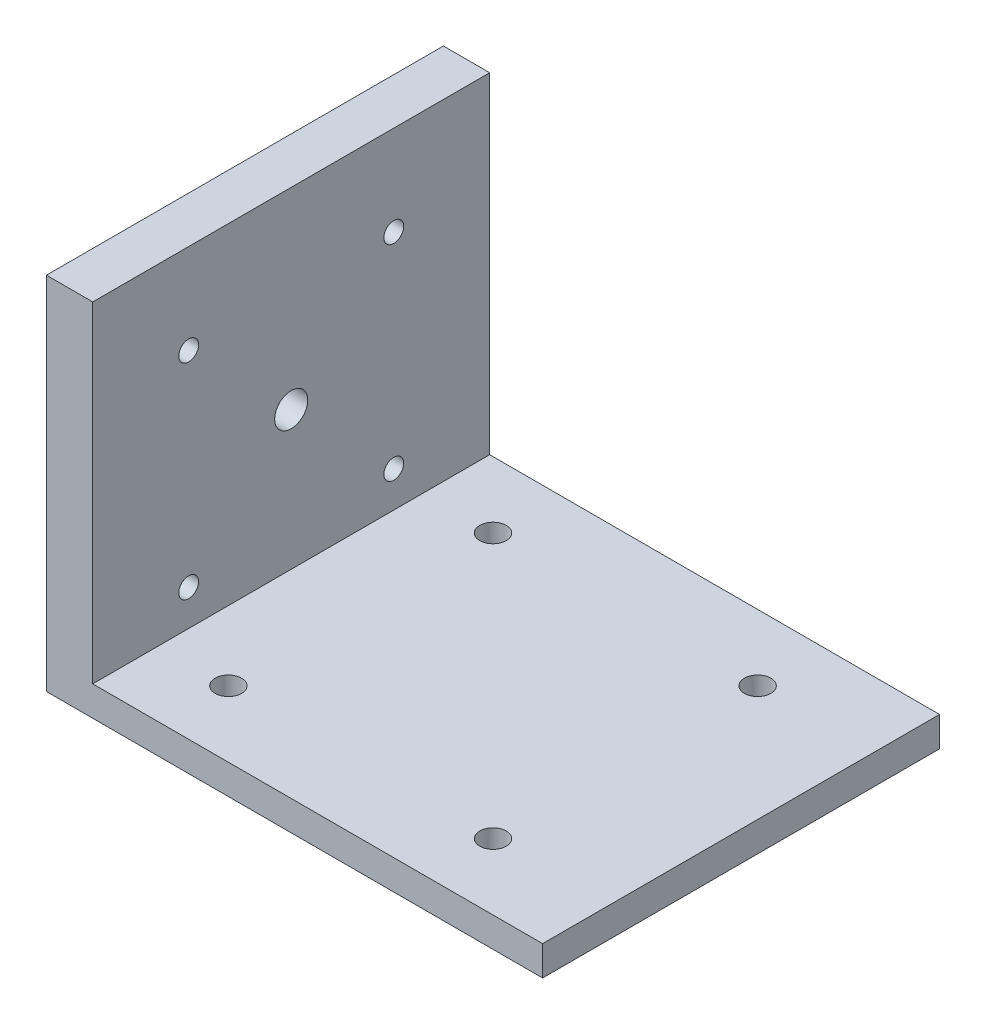
from build123d import *

# Parameters (mm, degrees)
SKETCH1_W           = 75
SKETCH1_H           = 60
BOSS_EXTRUDE1_DEPTH = 4.5
SKETCH2_W           = 7
SKETCH2_H           = 60
BOSS_EXTRUDE2_DEPTH = 50
SKETCH3_R           = 1.5
SKETCH3_R_2         = 2.5
CUT_EXTRUDE1_DEPTH  = 10
SKETCH6_R           = 2
CUT_EXTRUDE2_DEPTH  = 10


with BuildPart() as part:
    # Sketch1 → Boss-Extrude1 (new body)
    with BuildSketch(Plane(origin=(0, 0, 0), x_dir=(1, 0, 0), z_dir=(0, 1, 0))):
        Rectangle(SKETCH1_W, SKETCH1_H)
    extrude(amount=BOSS_EXTRUDE1_DEPTH)

    # Sketch2 → Boss-Extrude2 (add)
    with BuildSketch(Plane(origin=(0, 4.5, 0), x_dir=(1, 0, 0), z_dir=(0, 1, 0))):
        with Locations((-34, 0)):
            Rectangle(SKETCH2_W, SKETCH2_H)
    extrude(amount=BOSS_EXTRUDE2_DEPTH)

    # Sketch3 → Cut-Extrude1 (cut)
    with BuildSketch(Plane.ZY.offset(37.5)):
        with Locations((-15.5, 40.9)):
            Circle(SKETCH3_R)
        with Locations((15.5, 40.9)):
            Circle(SKETCH3_R)
        with Locations((15.5, 9.9)):
            Circle(SKETCH3_R)
        with Locations((-15.5, 9.9)):
            Circle(SKETCH3_R)
        with Locations((0, 25.4)):
            Circle(SKETCH3_R_2)
    extrude(amount=-CUT_EXTRUDE1_DEPTH, mode=Mode.SUBTRACT)

    # Sketch6 → Cut-Extrude2 (cut)
    with BuildSketch(Plane(origin=(0, 4.5, 0), x_dir=(1, 0, 0), z_dir=(0, 1, 0))):
        with Locations(Location((20, 20, 0), (0, 0, 270))):
            Circle(SKETCH6_R)
        with Locations(Location((-20, 20, 0), (0, 0, 270))):
            Circle(SKETCH6_R)
        with Locations(Location((20, -20, 0), (0, 0, 270))):
            Circle(SKETCH6_R)
        with Locations(Location((-20, -20, 0), (0, 0, 270))):
            Circle(SKETCH6_R)
    extrude(amount=-CUT_EXTRUDE2_DEPTH, mode=Mode.SUBTRACT)


solid = part.part
